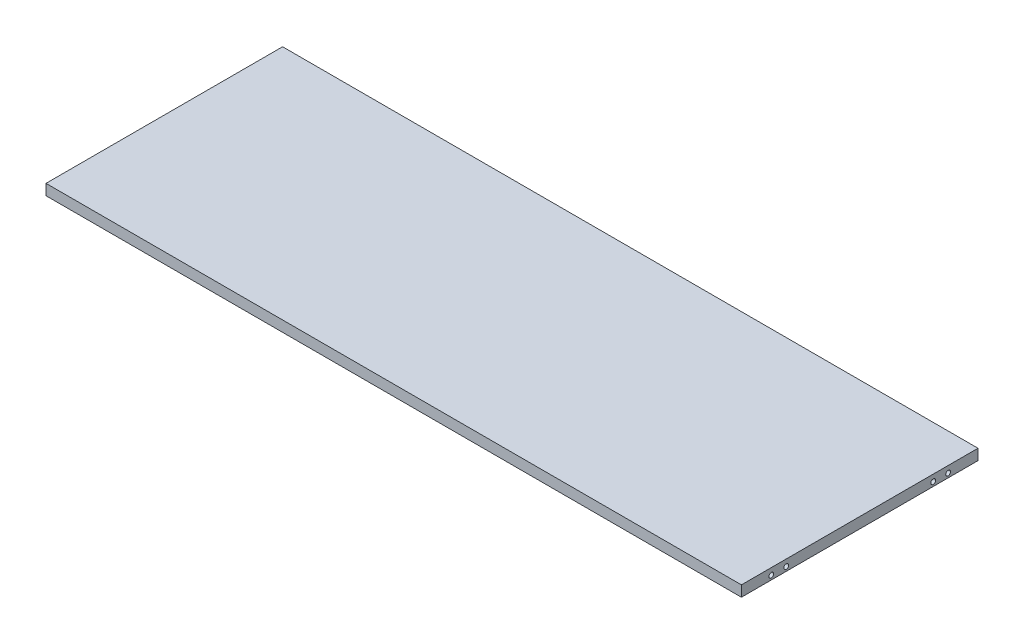
from build123d import *

# Parameters (mm, degrees)
SKETCH1_W                = 1164
SKETCH1_H                = 396
BASE_PANEL_DEPTH         = 18
SKETCH2_R                = 4
EXTRUDE2_DEPTH           = 15
EXTRUDE3_START           = -15
SKETCH3_R                = 4
EXTRUDE3_DEPTH           = 15
SKETCH5_R                = 15
EXTRUDE17_DEPTH          = 13
TAGLIO_ESTRUSIONE1_START = -18
SKETCH4_2_R              = 4
TAGLIO_ESTRUSIONE1_DEPTH = 10


with BuildPart() as part:
    # Sketch1 → Base Panel (new body)
    with BuildSketch(Plane(origin=(0, -18, 0), x_dir=(-1, 0, 0), z_dir=(0, 1, 0))):
        with Locations((582, -198)):
            Rectangle(SKETCH1_W, SKETCH1_H)
    extrude(amount=BASE_PANEL_DEPTH)

    # Sketch2 → Extrude2 (cut)
    with BuildSketch(Plane(origin=(-1164, 0, 0), x_dir=(0, 0, -1), z_dir=(1, 0, 0))):
        with Locations((50, -11)):
            Circle(SKETCH2_R)
        with Locations((75, -11)):
            Circle(SKETCH2_R)
        with Locations((321, -11)):
            Circle(SKETCH2_R)
        with Locations((346, -11)):
            Circle(SKETCH2_R)
    extrude(amount=EXTRUDE2_DEPTH, mode=Mode.SUBTRACT)

    # Sketch3 → Extrude3 (cut)
    with BuildSketch(Plane(origin=(0, 0, 0), x_dir=(0, 0, -1), z_dir=(1, 0, 0)).offset(EXTRUDE3_START)):
        with Locations((346, -11)):
            Circle(SKETCH3_R)
        with Locations((321, -11)):
            Circle(SKETCH3_R)
        with Locations((75, -11)):
            Circle(SKETCH3_R)
        with Locations((50, -11)):
            Circle(SKETCH3_R)
    extrude(amount=EXTRUDE3_DEPTH, mode=Mode.SUBTRACT)

    # Sketch5 → Extrude17 (cut)
    with BuildSketch(Plane(origin=(0, -18, 0), x_dir=(-1, 0, 0), z_dir=(0, 1, 0))):
        with Locations(Location((25, -50, 0), (0, 0, 90))):
            Circle(SKETCH5_R)
        with Locations(Location((25, -346, 0), (0, 0, 90))):
            Circle(SKETCH5_R)
        with Locations(Location((1139, -50, 0), (0, 0, 90))):
            Circle(SKETCH5_R)
        with Locations(Location((1139, -346, 0), (0, 0, 90))):
            Circle(SKETCH5_R)
    extrude(amount=EXTRUDE17_DEPTH, mode=Mode.SUBTRACT)

    # Sketch4<2> → Taglio-Estrusione1 (cut)
    with BuildSketch(Plane(origin=(0, 0, 0), x_dir=(1, 0, 0), z_dir=(0, 1, 0)).offset(TAGLIO_ESTRUSIONE1_START)):
        with Locations(Location((-582, 15, 0), (0, 0, 270))):
            Circle(SKETCH4_2_R)
        with Locations(Location((-582, 60, 0), (0, 0, 270))):
            Circle(SKETCH4_2_R)
    extrude(amount=TAGLIO_ESTRUSIONE1_DEPTH, mode=Mode.SUBTRACT)


solid = part.part
